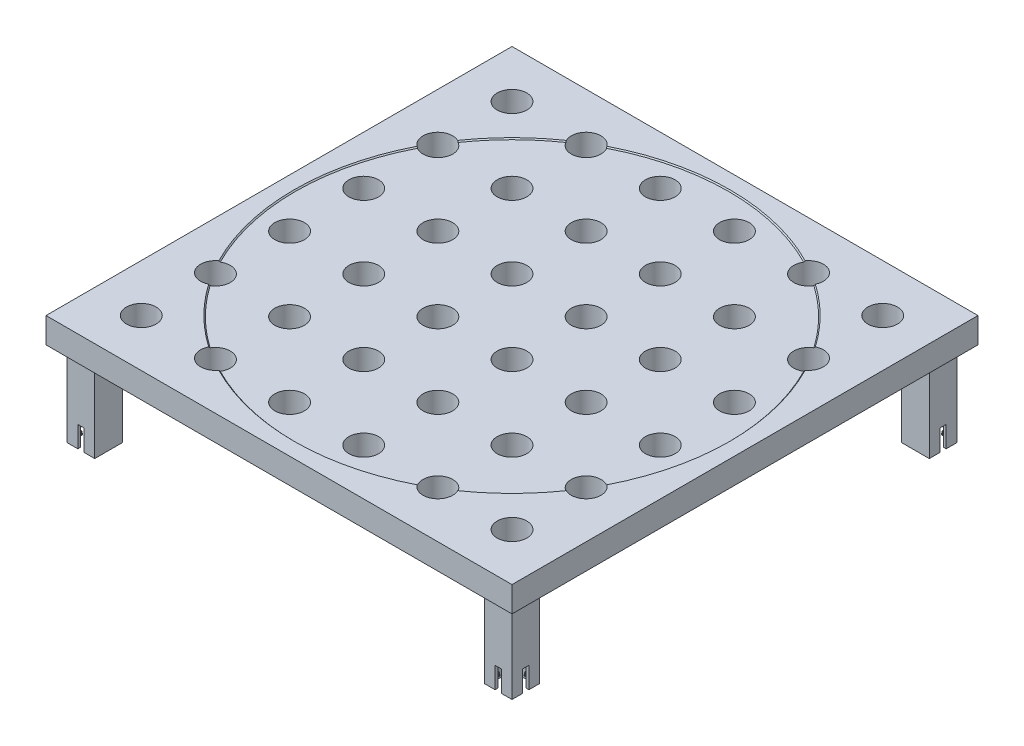
from build123d import *

# Parameters (mm, degrees)
SKETCH1_W                 = 220
SKETCH1_H                 = 220
BOSS_EXTRUDE1_DEPTH       = 12
SKETCH2_R                 = 7
CUT_EXTRUDE1_DEPTH        = 178.161121795
LPATTERN1_COUNT           = 6
LPATTERN1_PITCH           = 35
LPATTERN1_COUNT_DIR2      = 6
LPATTERN1_PITCH_DIR2      = 35
SKETCH4_R                 = 102.87
CUT_EXTRUDE2_DEPTH        = 0.5
CUT_EXTRUDE2_DRAFT        = -45
SKETCH5_W                 = 13
SKETCH5_H                 = 13
SKETCH5_W_2               = 10.3
SKETCH5_H_2               = 10.3
BOSS_EXTRUDE2_DEPTH       = 40
SKETCH6_W                 = 3
SKETCH6_H                 = 10
CUT_EXTRUDE3_DEPTH        = 1.5
SKETCH7_W                 = 3
SKETCH7_H                 = 10
CUT_EXTRUDE4_DEPTH        = 1.5
BOSS_EXTRUDE3_DEPTH       = 0.5
BOSS_EXTRUDE4_DEPTH       = 0.5
MIRROR1_COPY_1_DEPTH      = 0.5
MIRROR1_COPY_2_DEPTH      = 0.5
MIRROR2_COPY_1_DEPTH      = 0.5
MIRROR2_COPY_2_DEPTH      = 0.5
MIRROR2_COPY_3_SKETCH_W   = 13
MIRROR2_COPY_3_SKETCH_H   = 13
MIRROR2_COPY_3_SKETCH_W_2 = 10.3
MIRROR2_COPY_3_SKETCH_H_2 = 10.3
MIRROR2_COPY_3_DEPTH      = 40
MIRROR2_COPY_4_SKETCH_W   = 3
MIRROR2_COPY_4_SKETCH_H   = 10
MIRROR2_COPY_4_DEPTH      = 1.5
MIRROR2_COPY_5_SKETCH_W   = 3
MIRROR2_COPY_5_SKETCH_H   = 10
MIRROR2_COPY_5_DEPTH      = 1.5
MIRROR2_COPY_6_DEPTH      = 0.5
MIRROR2_COPY_7_DEPTH      = 0.5
MIRROR2_COPY_8_DEPTH      = 0.5
MIRROR2_COPY_9_DEPTH      = 0.5


with BuildPart() as part:
    # Sketch1 → Boss-Extrude1 (new body)
    with BuildSketch(Plane(origin=(0, 0, 0), x_dir=(1, 0, 0), z_dir=(0, 1, 0))):
        with Locations((-23.700680272, -5.612244898)):
            Rectangle(SKETCH1_W, SKETCH1_H)
    extrude(amount=BOSS_EXTRUDE1_DEPTH)

    # Sketch2 → Cut-Extrude1 (cut, through all)
    with BuildSketch(Plane(origin=(0, 12, 0), x_dir=(1, 0, 0), z_dir=(0, 1, 0))):
        with Locations(Location((-111.200680272, 81.887755102, 0), (0, 0, 270))):
            Circle(SKETCH2_R)
    cut_extrude1 = extrude(amount=-CUT_EXTRUDE1_DEPTH, mode=Mode.SUBTRACT)

    # LPattern1: Cut-Extrude1 6 × 6
    with Locations(*[(i * LPATTERN1_PITCH, 0, j * LPATTERN1_PITCH_DIR2) for i in range(LPATTERN1_COUNT) for j in range(LPATTERN1_COUNT_DIR2) if (i, j) != (0, 0)]):
        add(cut_extrude1, mode=Mode.SUBTRACT)


with BuildPart() as cut_extrude2_tool:
    # Sketch4 → Cut-Extrude2 (with draft: the straight prism first)
    with BuildSketch(Plane(origin=(0, 12, 0), x_dir=(1, 0, 0), z_dir=(0, 1, 0))):
        with Locations((-23.700680272, -5.612244898)):
            Circle(SKETCH4_R)
    extrude(amount=-CUT_EXTRUDE2_DEPTH)
    # Cut-Extrude2: the draft: its side faces are tilted about the plane it starts from
    cut_extrude2_sides = [cut_extrude2_tool.faces().sort_by_distance(p)[0] for p in [
        (-126.570680272, 11.75, 5.612244898),
    ]]
    draft(cut_extrude2_sides, Plane(origin=(0, 12, 0), x_dir=(1, 0, 0), z_dir=(0, 1, 0)), CUT_EXTRUDE2_DRAFT)


with BuildPart() as part_1:
    add(part.part)

    # Cut-Extrude2: cut by cut_extrude2_tool
    add(cut_extrude2_tool.part, mode=Mode.SUBTRACT)

    # Sketch5 → Boss-Extrude2 (add)
    with BuildSketch(Plane(origin=(0, 0, 0), x_dir=(-1, 0, 0), z_dir=(0, -1, 0))):
        with Locations((122.200680272, -104.112244898)):
            Rectangle(SKETCH5_W, SKETCH5_H)
        with Locations((122.200680272, -104.112244898)):
            Rectangle(SKETCH5_W_2, SKETCH5_H_2, mode=Mode.SUBTRACT)
    boss_extrude2 = extrude(amount=BOSS_EXTRUDE2_DEPTH)

    # Sketch6 → Cut-Extrude3 (cut)
    with BuildSketch(Plane.ZY.offset(128.700680272)):
        with Locations((104.112244898, -35)):
            Rectangle(SKETCH6_W, SKETCH6_H)
    cut_extrude3 = extrude(amount=-CUT_EXTRUDE3_DEPTH, mode=Mode.SUBTRACT)

    # Sketch7 → Cut-Extrude4 (cut)
    with BuildSketch(Plane.XY.offset(110.612244898)):
        with Locations((-122.200680272, -35)):
            Rectangle(SKETCH7_W, SKETCH7_H)
    cut_extrude4 = extrude(amount=-CUT_EXTRUDE4_DEPTH, mode=Mode.SUBTRACT)

    # Sketch11 → Boss-Extrude3 (add, symmetric)
    with BuildSketch(Plane.XY.offset(102.612244898)):
        Polygon((-127.350680272, -33), (-126.850680272, -35), (-127.350680272, -35), align=None)
    boss_extrude3 = extrude(amount=BOSS_EXTRUDE3_DEPTH, both=True)

    # Sketch12 → Boss-Extrude4 (add, symmetric)
    with BuildSketch(Plane(origin=(-123.700680272, 0, 0), x_dir=(0, 0, -1), z_dir=(1, 0, 0))):
        Polygon((-109.262244898, -33), (-108.762244898, -35), (-109.262244898, -35), align=None)
    boss_extrude4 = extrude(amount=BOSS_EXTRUDE4_DEPTH, both=True)

    # Mirror3: Boss-Extrude3 across plane
    add(boss_extrude3.mirror(Plane.XY.offset(104.112244898)))

    # Mirror4: Boss-Extrude4 across plane
    add(boss_extrude4.mirror(Plane(origin=(-122.200680272, 0, 0), x_dir=(0, 0, 1), z_dir=(1, 0, 0))))

    # Mirror1: Boss-Extrude2, Cut-Extrude3, Cut-Extrude4, Boss-Extrude3, Boss-Extrude4 across plane
    add(boss_extrude2.mirror(Plane.XY.offset(5.612244898)))
    add(cut_extrude3.mirror(Plane.XY.offset(5.612244898)), mode=Mode.SUBTRACT)
    add(cut_extrude4.mirror(Plane.XY.offset(5.612244898)), mode=Mode.SUBTRACT)
    add(boss_extrude3.mirror(Plane.XY.offset(5.612244898)))
    add(boss_extrude4.mirror(Plane.XY.offset(5.612244898)))

    # Mirror1 copy 1 sketch → Mirror1 copy 1 (add, symmetric)
    with BuildSketch(Plane.XY.offset(-94.387755102)):
        Polygon((-127.350680272, -33), (-126.850680272, -35), (-127.350680272, -35), align=None)
    extrude(amount=MIRROR1_COPY_1_DEPTH, both=True)

    # Mirror1 copy 2 sketch → Mirror1 copy 2 (add, symmetric)
    with BuildSketch(Plane(origin=(-120.700680272, 0, 11.224489796), x_dir=(0, 0, 1), z_dir=(-1, 0, 0))):
        Polygon((-109.262244898, -33), (-108.762244898, -35), (-109.262244898, -35), align=None)
    extrude(amount=MIRROR1_COPY_2_DEPTH, both=True)

    # Mirror2: Boss-Extrude2, Cut-Extrude3, Cut-Extrude4, Boss-Extrude3, Boss-Extrude4 across plane
    add(boss_extrude2.mirror(Plane(origin=(-23.700680272, 0, 0), x_dir=(0, 0, 1), z_dir=(1, 0, 0))))
    add(cut_extrude3.mirror(Plane(origin=(-23.700680272, 0, 0), x_dir=(0, 0, 1), z_dir=(1, 0, 0))), mode=Mode.SUBTRACT)
    add(cut_extrude4.mirror(Plane(origin=(-23.700680272, 0, 0), x_dir=(0, 0, 1), z_dir=(1, 0, 0))), mode=Mode.SUBTRACT)
    add(boss_extrude3.mirror(Plane(origin=(-23.700680272, 0, 0), x_dir=(0, 0, 1), z_dir=(1, 0, 0))))
    add(boss_extrude4.mirror(Plane(origin=(-23.700680272, 0, 0), x_dir=(0, 0, 1), z_dir=(1, 0, 0))))

    # Mirror2 copy 1 sketch → Mirror2 copy 1 (add, symmetric)
    with BuildSketch(Plane(origin=(-47.401360544, 0, 105.612244898), x_dir=(-1, 0, 0), z_dir=(0, 0, -1))):
        Polygon((-127.350680272, -33), (-126.850680272, -35), (-127.350680272, -35), align=None)
    extrude(amount=MIRROR2_COPY_1_DEPTH, both=True)

    # Mirror2 copy 2 sketch → Mirror2 copy 2 (add, symmetric)
    with BuildSketch(Plane(origin=(73.299319728, 0, 0), x_dir=(0, 0, -1), z_dir=(1, 0, 0))):
        Polygon((-109.262244898, -33), (-108.762244898, -35), (-109.262244898, -35), align=None)
    extrude(amount=MIRROR2_COPY_2_DEPTH, both=True)

    # Mirror2 copy 3 sketch → Mirror2 copy 3 (add)
    with BuildSketch(Plane(origin=(-47.401360544, 0, 11.224489796), x_dir=(1, 0, 0), z_dir=(0, -1, 0))):
        with Locations((122.200680272, -104.112244898)):
            Rectangle(MIRROR2_COPY_3_SKETCH_W, MIRROR2_COPY_3_SKETCH_H)
        with Locations((122.200680272, -104.112244898)):
            Rectangle(MIRROR2_COPY_3_SKETCH_W_2, MIRROR2_COPY_3_SKETCH_H_2, mode=Mode.SUBTRACT)
    extrude(amount=MIRROR2_COPY_3_DEPTH)

    # Mirror2 copy 4 sketch → Mirror2 copy 4 (cut)
    with BuildSketch(Plane(origin=(81.299319728, 0, 11.224489796), x_dir=(0, 0, -1), z_dir=(1, 0, 0))):
        with Locations((104.112244898, -35)):
            Rectangle(MIRROR2_COPY_4_SKETCH_W, MIRROR2_COPY_4_SKETCH_H)
    extrude(amount=-MIRROR2_COPY_4_DEPTH, mode=Mode.SUBTRACT)

    # Mirror2 copy 5 sketch → Mirror2 copy 5 (cut)
    with BuildSketch(Plane(origin=(-47.401360544, 0, -99.387755102), x_dir=(-1, 0, 0), z_dir=(0, 0, -1))):
        with Locations((-122.200680272, -35)):
            Rectangle(MIRROR2_COPY_5_SKETCH_W, MIRROR2_COPY_5_SKETCH_H)
    extrude(amount=-MIRROR2_COPY_5_DEPTH, mode=Mode.SUBTRACT)

    # Mirror2 copy 6 sketch → Mirror2 copy 6 (add, symmetric)
    with BuildSketch(Plane(origin=(-47.401360544, 0, -91.387755102), x_dir=(-1, 0, 0), z_dir=(0, 0, -1))):
        Polygon((-127.350680272, -33), (-126.850680272, -35), (-127.350680272, -35), align=None)
    extrude(amount=MIRROR2_COPY_6_DEPTH, both=True)

    # Mirror2 copy 7 sketch → Mirror2 copy 7 (add, symmetric)
    with BuildSketch(Plane(origin=(76.299319728, 0, 11.224489796), x_dir=(0, 0, 1), z_dir=(-1, 0, 0))):
        Polygon((-109.262244898, -33), (-108.762244898, -35), (-109.262244898, -35), align=None)
    extrude(amount=MIRROR2_COPY_7_DEPTH, both=True)

    # Mirror2 copy 8 sketch → Mirror2 copy 8 (add, symmetric)
    with BuildSketch(Plane(origin=(-47.401360544, 0, -94.387755102), x_dir=(-1, 0, 0), z_dir=(0, 0, 1))):
        Polygon((-127.350680272, 33), (-126.850680272, 35), (-127.350680272, 35), align=None)
    extrude(amount=MIRROR2_COPY_8_DEPTH, both=True)

    # Mirror2 copy 9 sketch → Mirror2 copy 9 (add, symmetric)
    with BuildSketch(Plane(origin=(73.299319728, 0, 11.224489796), x_dir=(0, 0, 1), z_dir=(1, 0, 0))):
        Polygon((-109.262244898, 33), (-108.762244898, 35), (-109.262244898, 35), align=None)
    extrude(amount=MIRROR2_COPY_9_DEPTH, both=True)


solid = part_1.part
